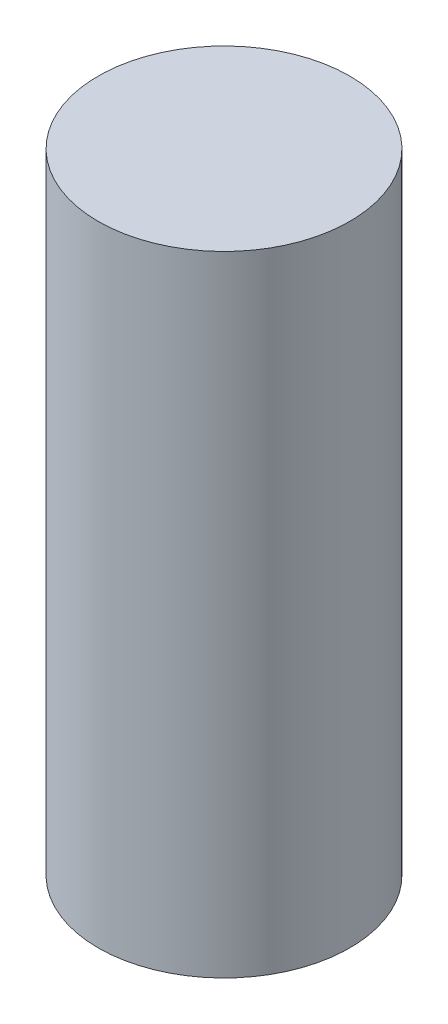
from build123d import *

# Parameters (mm, degrees)
SKETCH1_R           = 4
BOSS_EXTRUDE1_DEPTH = 20


with BuildPart() as part:
    # Sketch1 → Boss-Extrude1 (new body)
    with BuildSketch(Plane(origin=(0, 0, 0), x_dir=(1, 0, 0), z_dir=(0, 1, 0))):
        with Locations(Location((0, 0, 0), (0, 0, 270))):
            Circle(SKETCH1_R)
    extrude(amount=BOSS_EXTRUDE1_DEPTH)


solid = part.part
